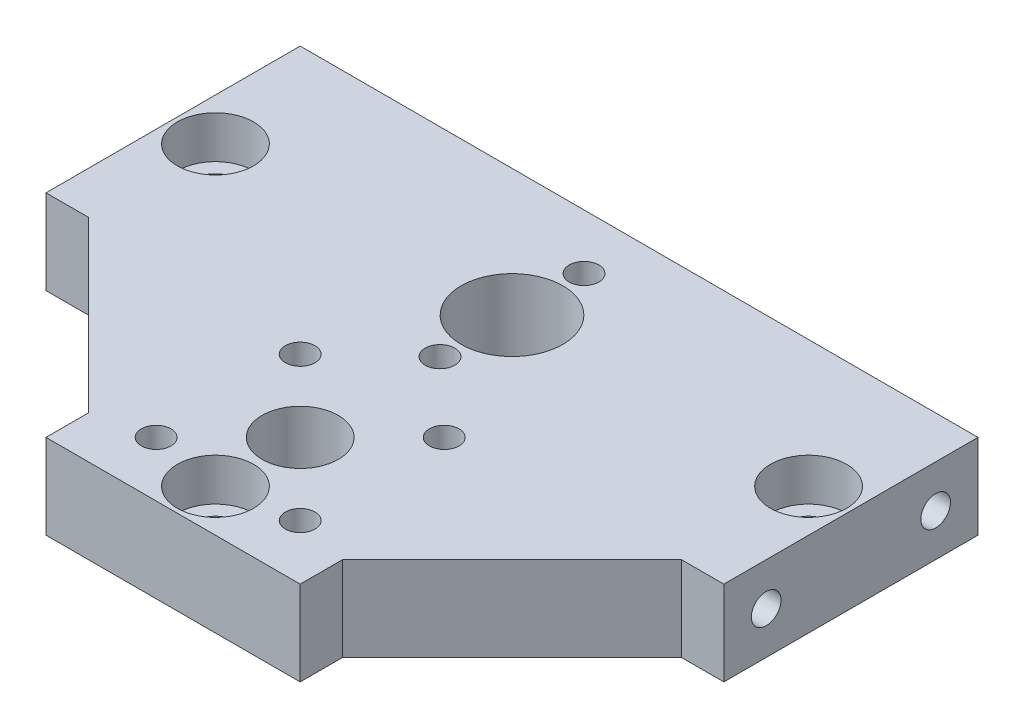
from build123d import *

# Parameters (mm, degrees)
SKETCH1_W           = 80
SKETCH1_H           = 30
SKETCH1_R           = 1.75
SKETCH1_R_2         = 6
SKETCH1_R_3         = 2.75
BOSS_EXTRUDE1_DEPTH = 10
SKETCH4_W           = 25
SKETCH4_H           = 10
BOSS_EXTRUDE3_DEPTH = 15
SKETCH5_R           = 2.75
CUT_EXTRUDE1_DEPTH  = 30
CHAMFER2_SIZE       = 20
SKETCH6_R           = 1.75
SKETCH6_R_2         = 4.5
CUT_EXTRUDE2_DEPTH  = 30
SKETCH8_R           = 1.75
CUT_EXTRUDE3_DEPTH  = 91
CUT_EXTRUDE13_START = -5
SKETCH12_R          = 4.5
CUT_EXTRUDE13_DEPTH = 53.445626552
CHAMFER3_SIZE       = 1


with BuildPart() as part:
    # Sketch1 → Boss-Extrude1 (new body)
    with BuildSketch(Plane(origin=(0, 0, 0), x_dir=(1, 0, 0), z_dir=(0, 1, 0))):
        Rectangle(SKETCH1_W, SKETCH1_H)
        with Locations(Location((0, 8.5, 0), (0, 0, 270))):
            Circle(SKETCH1_R, mode=Mode.SUBTRACT)
        with Locations(Location((0, -8.5, 0), (0, 0, 270))):
            Circle(SKETCH1_R, mode=Mode.SUBTRACT)
        with Locations(Location((0, 0, 0), (0, 0, 270))):
            Circle(SKETCH1_R_2, mode=Mode.SUBTRACT)
        with Locations(Location((-35, 0, 0), (0, 0, 270))):
            Circle(SKETCH1_R_3, mode=Mode.SUBTRACT)
        with Locations(Location((35, 0, 0), (0, 0, 270))):
            Circle(SKETCH1_R_3, mode=Mode.SUBTRACT)
    extrude(amount=BOSS_EXTRUDE1_DEPTH)

    # Sketch4 → Boss-Extrude3 (add, symmetric)
    with BuildSketch(Plane(origin=(0, 0, 0), x_dir=(0, 0, -1), z_dir=(1, 0, 0))):
        with Locations((-27.5, 5)):
            Rectangle(SKETCH4_W, SKETCH4_H)
    extrude(amount=BOSS_EXTRUDE3_DEPTH, both=True)

    # Sketch5 → Cut-Extrude1 (cut)
    with BuildSketch(Plane(origin=(0, 10, 0), x_dir=(1, 0, 0), z_dir=(0, 1, 0))):
        with Locations(Location((0, -35, 0), (0, 0, 270))):
            Circle(SKETCH5_R)
    extrude(amount=-CUT_EXTRUDE1_DEPTH, mode=Mode.SUBTRACT)

    # Chamfer2
    chamfer2_edges = [part.edges().sort_by_distance(p)[0] for p in [
        (-15, 5, 15),
        (15, 5, 15),
    ]]
    chamfer(chamfer2_edges, length=CHAMFER2_SIZE)

    # Sketch6 → Cut-Extrude2 (cut)
    with BuildSketch(Plane(origin=(0, 10, 0), x_dir=(1, 0, 0), z_dir=(0, 1, 0))):
        with Locations(Location((-8.5, -16.5, 0), (0, 0, 270))):
            Circle(SKETCH6_R)
        with Locations(Location((8.5, -16.5, 0), (0, 0, 270))):
            Circle(SKETCH6_R)
        with Locations(Location((8.5, -33.5, 0), (0, 0, 270))):
            Circle(SKETCH6_R)
        with Locations(Location((-8.5, -33.5, 0), (0, 0, 270))):
            Circle(SKETCH6_R)
        with Locations(Location((0, -25, 0), (0, 0, 270))):
            Circle(SKETCH6_R_2)
    extrude(amount=-CUT_EXTRUDE2_DEPTH, mode=Mode.SUBTRACT)

    # Sketch8 → Cut-Extrude3 (cut, through all)
    with BuildSketch(Plane(origin=(40, 0, 0), x_dir=(0, 0, -1), z_dir=(1, 0, 0))):
        with Locations((-10, 5)):
            Circle(SKETCH8_R)
        with Locations((10, 5)):
            Circle(SKETCH8_R)
    extrude(amount=-CUT_EXTRUDE3_DEPTH, mode=Mode.SUBTRACT)

    # Sketch12 → Cut-Extrude13 (cut, through all)
    with BuildSketch(Plane.XZ.offset(CUT_EXTRUDE13_START)):
        with Locations(Location((0, 35, 0), (0, 0, 270))):
            Circle(SKETCH12_R)
        with Locations(Location((35, 0, 0), (0, 0, 270))):
            Circle(SKETCH12_R)
        with Locations(Location((-35, 0, 0), (0, 0, 270))):
            Circle(SKETCH12_R)
    extrude(amount=-CUT_EXTRUDE13_DEPTH, mode=Mode.SUBTRACT)

    # Chamfer3
    chamfer3_edges = [part.edges().sort_by_distance(p)[0] for p in [
        (-8.5, 0, 14.75),
        (8.5, 0, 31.75),
        (-8.5, 0, 31.75),
        (8.5, 0, 14.75),
    ]]
    chamfer(chamfer3_edges, length=CHAMFER3_SIZE)


solid = part.part
